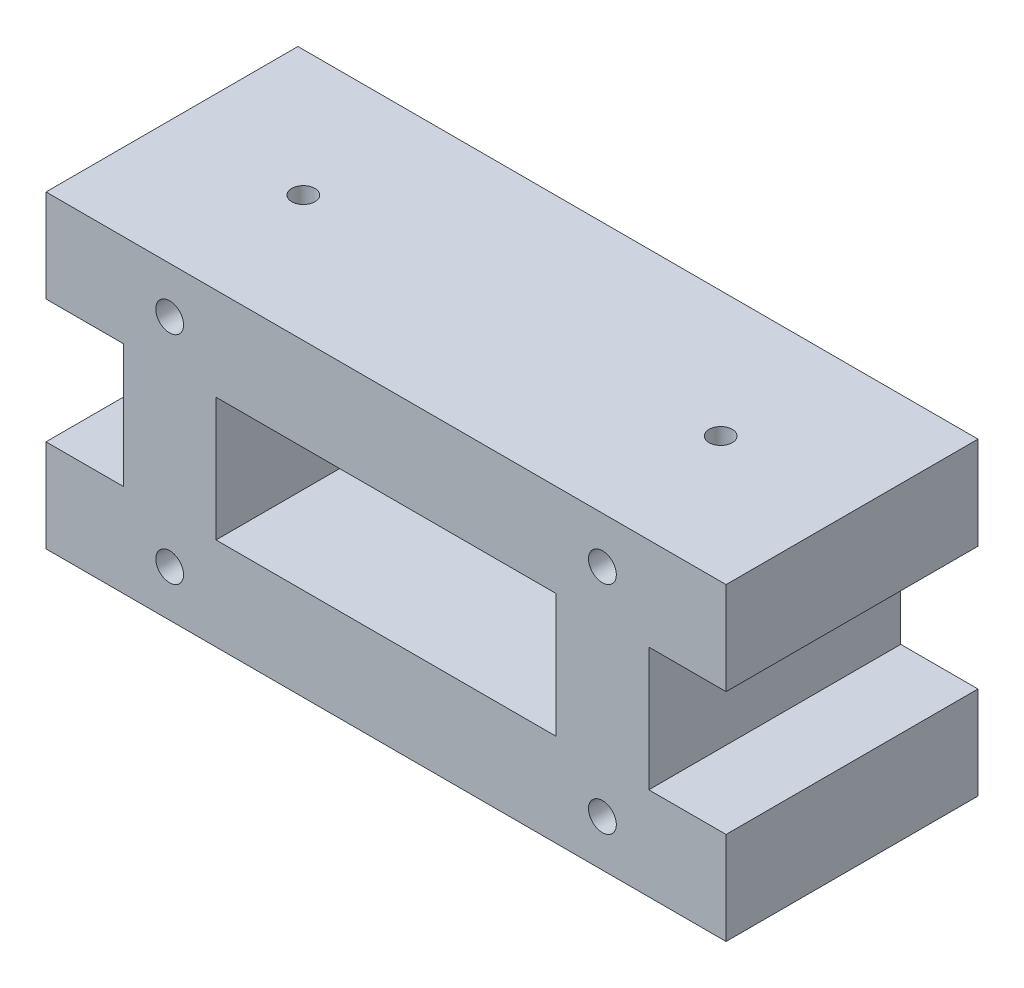
from build123d import *

# Parameters (mm, degrees)
SKETCH_1_R          = 0.9
SKETCH_1_W          = 6
SKETCH_1_H          = 8
EXTRUDE_1_DEPTH     = 16.3
SKETCH_2_R          = 0.75
CUT_EXTRUDE_1_DEPTH = 4
CUT_EXTRUDE_START   = -16
SKETCH_2_3_R        = 0.75
CUT_EXTRUDE_2_DEPTH = 4


with BuildPart() as part:
    # 草图1 → 凸台-拉伸1 (new body)
    # profile 1 of 4: a face of its own
    with BuildSketch(Plane.XY):
        Polygon((44, 10), (0, 10), (0, 4), (5, 4), (11, 4), (33, 4), (39, 4), (44, 4), align=None)
        with Locations((8, 7)):
            Circle(SKETCH_1_R, mode=Mode.SUBTRACT)
        with Locations((36, 7)):
            Circle(SKETCH_1_R, mode=Mode.SUBTRACT)
    # profile 2 of 4: a face of its own
    with BuildSketch(Plane.XY):
        Polygon((5, -4), (0, -4), (0, -10), (44, -10), (44, -4), (39, -4), (33, -4), (11, -4), align=None)
        with Locations((8, -7)):
            Circle(SKETCH_1_R, mode=Mode.SUBTRACT)
        with Locations((36, -7)):
            Circle(SKETCH_1_R, mode=Mode.SUBTRACT)
    # profile 3 of 4: a face of its own
    with BuildSketch(Plane.XY):
        with Locations((8, 0)):
            Rectangle(SKETCH_1_W, SKETCH_1_H)
    # profile 4 of 4: a face of its own
    with BuildSketch(Plane.XY):
        with Locations((36, 0)):
            Rectangle(SKETCH_1_W, SKETCH_1_H)
    extrude(amount=EXTRUDE_1_DEPTH)

    # 草图2 → 切除-拉伸1 (cut)
    with BuildSketch(Plane(origin=(0, 10, 0), x_dir=(1, 0, 0), z_dir=(0, 1, 0))):
        with Locations(Location((8.5, -8.15, 0), (0, 0, 180))):
            Circle(SKETCH_2_R)
        with Locations(Location((35.5, -8.15, 0), (0, 0, 180))):
            Circle(SKETCH_2_R)
    extrude(amount=-CUT_EXTRUDE_1_DEPTH, mode=Mode.SUBTRACT)

    # 草图2<3> → 切除-拉伸2 (cut)
    with BuildSketch(Plane(origin=(0, 10, 0), x_dir=(1, 0, 0), z_dir=(0, 1, 0)).offset(CUT_EXTRUDE_START)):
        with Locations(Location((8.5, -8.15, 0), (0, 0, 180))):
            Circle(SKETCH_2_3_R)
        with Locations(Location((35.5, -8.15, 0), (0, 0, 180))):
            Circle(SKETCH_2_3_R)
    extrude(amount=-CUT_EXTRUDE_2_DEPTH, mode=Mode.SUBTRACT)


solid = part.part
